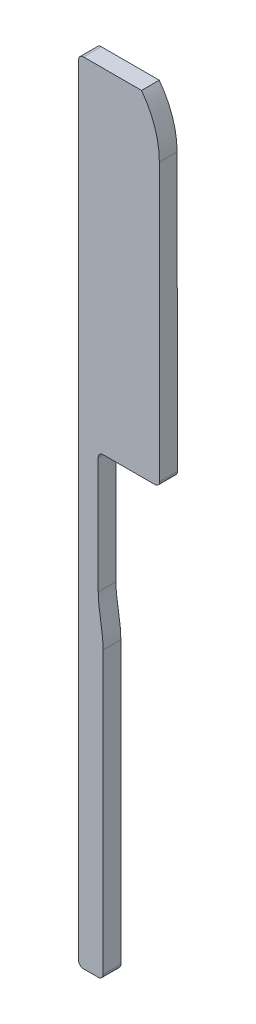
from build123d import *

# Parameters (mm, degrees)
BOSS_EXTRUDE1_DEPTH = 1.8
FILLET1_R           = 0.5
SKETCH5_R           = 2.5
SKETCH5_R_2         = 1.75
BOSS_EXTRUDE2_DEPTH = 1.8
FILLET2_R           = 1
CUT_EXTRUDE1_DEPTH  = 86.48993183
FILLET3_R           = 0.5


with BuildPart() as part:
    # Sketch1 → Boss-Extrude1 (new body)
    with BuildSketch(Plane.XY):
        with BuildLine():
            Line((0, 4.5), (0, 6.5))
            Line((0, 6.5), (6.1, 6.5))
            Line((6.1, 6.5), (6.1, 10.5))
            Line((6.1, 10.5), (10, 14.4))
            Line((10, 14.4), (10, 83.5))
            Line((10, 83.5), (16.4, 83.5))
            ThreePointArc((16.4, 83.5), (17.745328581, 80.945017946), (18.212299295, 78.095495067))
            Line((18.212299295, 78.095495067), (18.25, 49.5))
            Line((18.25, 49.5), (12, 49.5))
            Line((12, 49.5), (12, 37.18))
            add(Edge.make_bspline(
                [(12, 37.18), (12, 35.554764974), (12.5, 33.972282338), (12.5, 32.33)],
                knots=[0, 0, 0, 0, 1, 1, 1, 1], degree=3))
            Line((12.5, 32.33), (12.5, 3.07))
            ThreePointArc((12.5, 3.07), (11.600817818, 0.899182182), (9.43, 0))
            ThreePointArc((9.43, 0), (4.205660329, 1.182650422), (0, 4.5))
        make_face()
    extrude(amount=BOSS_EXTRUDE1_DEPTH)

    # Fillet1
    fillet1_edges = [part.edges().sort_by_distance(p)[0] for p in [
        (0, 6.5, 0.9),
        (6.1, 6.5, 0.9),
        (6.1, 10.5, 0.9),
        (10, 14.4, 0.9),
        (10, 83.5, 0.9),
        (18.25, 49.5, 0.9),
        (12, 49.5, 0.9),
    ]]
    fillet(fillet1_edges, radius=FILLET1_R)

    # Sketch5 → Boss-Extrude2 (add)
    # profile 1 of 3: a face of its own
    with BuildSketch(Plane(origin=(0, 0, 0), x_dir=(-1, 0, 0), z_dir=(0, 0, -1))):
        with Locations((-9.5, -2.499832541)):
            Circle(SKETCH5_R)
        with Locations((-9.5, -2.499832541)):
            Circle(SKETCH5_R_2, mode=Mode.SUBTRACT)
    # profile 2 of 3: a face of its own
    with BuildSketch(Plane(origin=(0, 0, 0), x_dir=(-1, 0, 0), z_dir=(0, 0, -1))):
        with BuildLine():
            ThreePointArc((-11.824045318, -1.578521867), (-9.031018815, -0.044215175), (-7, -2.499832541))
            Line((-7, -2.499832541), (-7, 0.245881701))
            ThreePointArc((-7, 0.245881701), (-8.2087959, 0.061626967), (-9.43, 0))
            ThreePointArc((-9.43, 0), (-10.256451345, 0.113333266), (-11.021883517, 0.444965358))
            Line((-11.021883517, 0.444965358), (-11.824045318, -1.578521867))
        make_face()
    # profile 3 of 3: a face of its own
    with BuildSketch(Plane(origin=(0, 0, 0), x_dir=(-1, 0, 0), z_dir=(0, 0, -1))):
        with BuildLine():
            ThreePointArc((-9.43, 0), (-8.2087959, 0.061626967), (-7, 0.245881701))
            Line((-7, 0.245881701), (-7, 0.500167459))
            Line((-7, 0.500167459), (-11, 0.500167459))
            Line((-11, 0.500167459), (-11.021883517, 0.444965358))
            ThreePointArc((-11.021883517, 0.444965358), (-10.256451345, 0.113333266), (-9.43, 0))
        make_face()
    extrude(amount=-BOSS_EXTRUDE2_DEPTH)

    # Fillet2
    fillet2_edges = [part.edges().sort_by_distance(p)[0] for p in [
        (7, 0.245881701, 0.9),
        (11.021883517, 0.444965358, 0.9),
    ]]
    fillet(fillet2_edges, radius=FILLET2_R)

    # Sketch6 → Cut-Extrude1 (cut, through all)
    with BuildSketch(Plane.XY.offset(1.8)):
        Polygon((10, 23.170696855), (10, 3.27), (15.071898879, 3.27), (15.071898879, -7.898815654), (-3.496989456, -7.898815654), (-3.496989456, 23.170696855), align=None)
    extrude(amount=-CUT_EXTRUDE1_DEPTH, mode=Mode.SUBTRACT)

    # Fillet3
    fillet3_edges = [part.edges().sort_by_distance(p)[0] for p in [
        (12.5, 3.27, 0.9),
        (10, 3.27, 0.9),
    ]]
    fillet(fillet3_edges, radius=FILLET3_R)


solid = part.part
